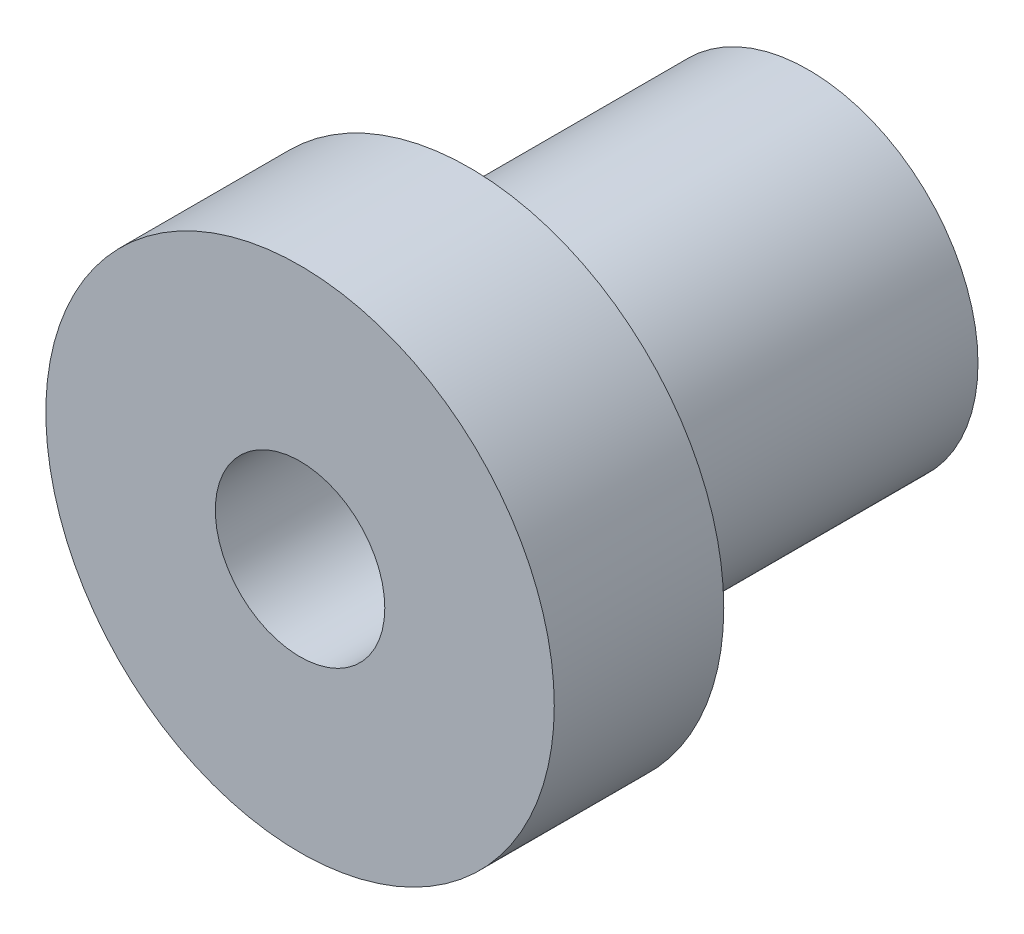
from build123d import *


with BuildPart() as part:
    # Sketch2 → Revolve1 (revolve)
    with BuildSketch(Plane(origin=(0, 0, 0), x_dir=(0, 0, -1), z_dir=(1, 0, 0)), mode=Mode.PRIVATE) as revolve1_sk:
        Polygon((-3.175, 1.5875), (6.35, 1.5875), (6.35, 3.175), (0, 3.175), (0, 4.7625), (-3.175, 4.7625), align=None)
    revolve(revolve1_sk.sketch.rotate(Axis((0, 0, 3.175), (0, 0, -1)), 90), axis=Axis((0, 0, 3.175), (0, 0, -1)))


solid = part.part
